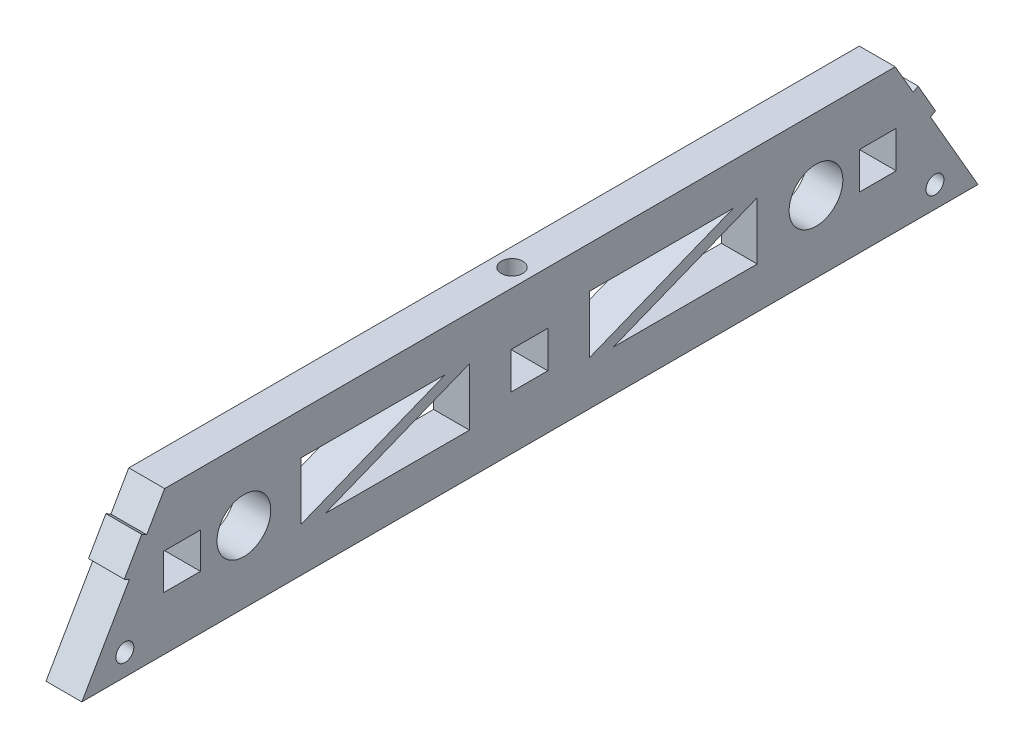
from build123d import *

# Parameters (mm, degrees)
SKETCH1_R                 = 4.7625
SKETCH1_W                 = 6.5278
SKETCH1_H                 = 6.5278
SKETCH1_H_2               = 6.348837221
BOSS_EXTRUDE1_DEPTH       = 6.35
F_6_CLEARANCE_HOLE1_D     = 3.7973
F_6_CLEARANCE_HOLE1_DEPTH = 12.7
F_6_CLEARANCE_HOLE1_TIP   = 1.140824014
SKETCH7_W                 = 6.35
SKETCH7_H                 = 6.1722
BOSS_EXTRUDE2_DEPTH       = 1.016
SKETCH8_W                 = 6.35
SKETCH8_H                 = 6.1722
BOSS_EXTRUDE3_DEPTH       = 1.016
SKETCH9_R                 = 1.5875
CUT_EXTRUDE1_DEPTH        = 161.894515133
CUT_EXTRUDE2_DEPTH        = 161.894515133


with BuildPart() as part:
    # Sketch1 → Boss-Extrude1 (new body)
    with BuildSketch(Plane(origin=(0, 0, 0), x_dir=(0, 0, -1), z_dir=(1, 0, 0))):
        Polygon((0, 0), (-14.664696837, 25.4), (-144.085303163, 25.4), (-158.75, 0), align=None)
        with Locations((-130.048, 12.7)):
            Circle(SKETCH1_R, mode=Mode.SUBTRACT)
        with Locations((-28.702, 12.7)):
            Circle(SKETCH1_R, mode=Mode.SUBTRACT)
        with Locations((-17.750796837, 12.6111)):
            Rectangle(SKETCH1_W, SKETCH1_H, mode=Mode.SUBTRACT)
        with Locations((-140.999203163, 12.70058139)):
            Rectangle(SKETCH1_W, SKETCH1_H_2, mode=Mode.SUBTRACT)
        with Locations((-79.4639, 12.7889)):
            Rectangle(SKETCH1_W, SKETCH1_H, mode=Mode.SUBTRACT)
    extrude(amount=BOSS_EXTRUDE1_DEPTH)

    # #6 Clearance Hole1
    with Locations(Plane(origin=(0, 25.4, 0), x_dir=(1, 0, 0), z_dir=(0, 1, 0))):
        with Locations((3.175, -79.375)):
            Hole(F_6_CLEARANCE_HOLE1_D / 2, depth=F_6_CLEARANCE_HOLE1_DEPTH)
            with Locations((0, 0, -(F_6_CLEARANCE_HOLE1_DEPTH + F_6_CLEARANCE_HOLE1_TIP / 2))):  # 118° drill point
                Cone(0, F_6_CLEARANCE_HOLE1_D / 2, F_6_CLEARANCE_HOLE1_TIP, mode=Mode.SUBTRACT)

    # Sketch7 → Boss-Extrude2 (add)
    with BuildSketch(Plane(origin=(0, 0, 0), x_dir=(-1, 0, 0), z_dir=(0, 0.499999999999998, -0.8660254037844397))):
        with Locations((-3.175, 19.893293675)):
            Rectangle(SKETCH7_W, SKETCH7_H)
    extrude(amount=BOSS_EXTRUDE2_DEPTH)

    # Sketch8 → Boss-Extrude3 (add)
    with BuildSketch(Plane(origin=(0, 68.740766425, 119.0625), x_dir=(1, 0, 0), z_dir=(0, 0.500000000000004, 0.8660254037844365))):
        with Locations((3.175, -59.481706325)):
            Rectangle(SKETCH8_W, SKETCH8_H)
    extrude(amount=BOSS_EXTRUDE3_DEPTH)

    # Sketch9 → Cut-Extrude1 (cut, through all)
    with BuildSketch(Plane(origin=(6.35, 0, 0), x_dir=(0, 0, -1), z_dir=(1, 0, 0))):
        with Locations((-151.13, 3.81)):
            Circle(SKETCH9_R)
        with Locations((-7.62, 3.81)):
            Circle(SKETCH9_R)
    extrude(amount=-CUT_EXTRUDE1_DEPTH, mode=Mode.SUBTRACT)

    # Sketch10 → Cut-Extrude2 (cut, through all)
    with BuildSketch(Plane(origin=(6.35, 0, 0), x_dir=(0, 0, -1), z_dir=(1, 0, 0))):
        Polygon((-90.0938, 7.366), (-90.0938, 17.550906382), (-115.628105199, 7.366), align=None)
        Polygon((-119.901628846, 7.849093618), (-94.367323648, 18.034), (-119.901628846, 18.034), align=None)
        Polygon((-68.834, 7.850665489), (-43.375663722, 18.034), (-68.834, 18.034), align=None)
        Polygon((-39.116, 7.366), (-39.116, 17.549334511), (-64.574336278, 7.366), align=None)
    extrude(amount=-CUT_EXTRUDE2_DEPTH, mode=Mode.SUBTRACT)


solid = part.part
